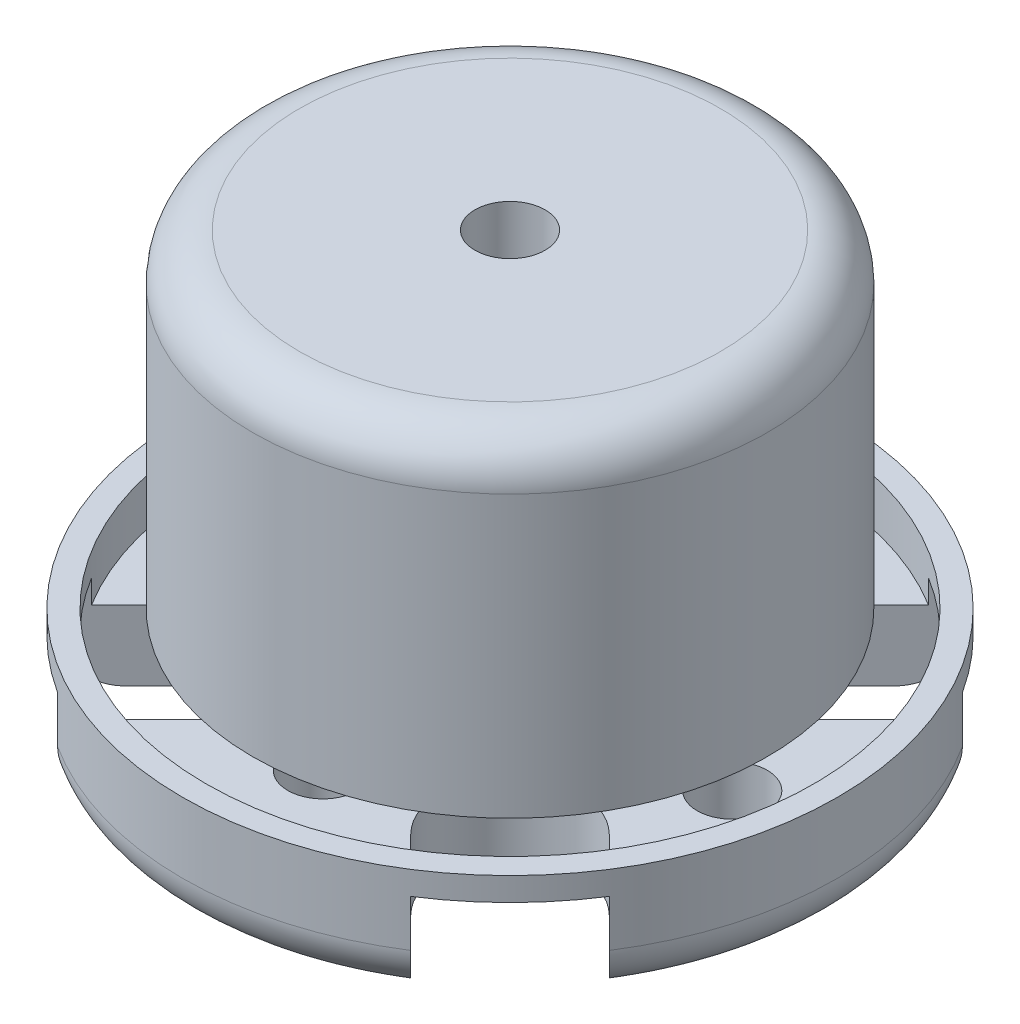
from build123d import *

# Parameters (mm, degrees)
SKETCH_1_R          = 14
SKETCH_1_R_2        = 1.5
EXTRUDE_1_DEPTH     = 5
SKETCH_2_R          = 13
SKETCH_2_R_2        = 4.5
CUT_EXTRUDE_1_DEPTH = 2
SKETCH_3_R          = 1.5
CUT_EXTRUDE_2_DEPTH = 21.420577857
SKETCH_4_R          = 4
CUT_EXTRUDE_3_DEPTH = 3
CUT_EXTRUDE_4_DEPTH = 4
FILLET_1_R          = 2
EXTRUDE_START       = 14
SKETCH_6_R          = 11
SKETCH_6_R_2        = 1.5
EXTRUDE_3_DEPTH     = 14
FILLET_2_R          = 2


with BuildPart() as part:
    # 草图1 → 凸台-拉伸1 (new body)
    with BuildSketch(Plane(origin=(0, 0, 0), x_dir=(1, 0, 0), z_dir=(0, 1, 0))):
        with Locations(Location((0, 0, 0), (0, 0, 270))):
            Circle(SKETCH_1_R)
        with Locations(Location((-9.5, 0, 0), (0, 0, 270))):
            Circle(SKETCH_1_R_2, mode=Mode.SUBTRACT)
        with Locations(Location((9.5, 0, 0), (0, 0, 270))):
            Circle(SKETCH_1_R_2, mode=Mode.SUBTRACT)
        with Locations(Location((0, 8, 0), (0, 0, 270))):
            Circle(SKETCH_1_R_2, mode=Mode.SUBTRACT)
        with Locations(Location((0, -8, 0), (0, 0, 270))):
            Circle(SKETCH_1_R_2, mode=Mode.SUBTRACT)
    extrude(amount=EXTRUDE_1_DEPTH)

    # 草图2 → 切除-拉伸1 (cut)
    with BuildSketch(Plane(origin=(0, 5, 0), x_dir=(1, 0, 0), z_dir=(0, 1, 0))):
        with Locations(Location((0, 0, 0), (0, 0, 270))):
            Circle(SKETCH_2_R)
        with Locations(Location((0, 0, 0), (0, 0, 270))):
            Circle(SKETCH_2_R_2, mode=Mode.SUBTRACT)
    extrude(amount=-CUT_EXTRUDE_1_DEPTH, mode=Mode.SUBTRACT)

    # 草图3 → 切除-拉伸2 (cut, through all)
    with BuildSketch(Plane(origin=(0, 5, 0), x_dir=(1, 0, 0), z_dir=(0, 1, 0))):
        with Locations(Location((0, 0, 0), (0, 0, 270))):
            Circle(SKETCH_3_R)
    extrude(amount=-CUT_EXTRUDE_2_DEPTH, mode=Mode.SUBTRACT)

    # 草图4 → 切除-拉伸3 (cut)
    with BuildSketch(Plane.XZ):
        with Locations(Location((0, 0, 0), (0, 0, 270))):
            Circle(SKETCH_4_R)
    extrude(amount=-CUT_EXTRUDE_3_DEPTH, mode=Mode.SUBTRACT)

    # 草图5 → 切除-拉伸4 (cut)
    with BuildSketch(Plane.XZ):
        with BuildLine():
            Line((8.485281374, 4.242640687), (11.790860146, 7.548219459))
            ThreePointArc((11.790860146, 7.548219459), (9.899494937, 9.899494937), (7.548219459, 11.790860146))
            Line((7.548219459, 11.790860146), (4.242640687, 8.485281374))
            ThreePointArc((4.242640687, 8.485281374), (4.242640687, 4.242640687), (8.485281374, 4.242640687))
        make_face()
        with BuildLine():
            Line((8.485281374, -4.242640687), (11.790860146, -7.548219459))
            ThreePointArc((11.790860146, -7.548219459), (9.899494937, -9.899494937), (7.548219459, -11.790860146))
            Line((7.548219459, -11.790860146), (4.242640687, -8.485281374))
            ThreePointArc((4.242640687, -8.485281374), (4.242640687, -4.242640687), (8.485281374, -4.242640687))
        make_face()
        with BuildLine():
            Line((-4.242640687, -8.485281374), (-7.548219459, -11.790860146))
            ThreePointArc((-7.548219459, -11.790860146), (-9.899494937, -9.899494937), (-11.790860146, -7.548219459))
            Line((-11.790860146, -7.548219459), (-8.485281374, -4.242640687))
            ThreePointArc((-8.485281374, -4.242640687), (-4.242640687, -4.242640687), (-4.242640687, -8.485281374))
        make_face()
        with BuildLine():
            Line((-8.485281374, 4.242640687), (-11.790860146, 7.548219459))
            ThreePointArc((-11.790860146, 7.548219459), (-9.899494937, 9.899494937), (-7.548219459, 11.790860146))
            Line((-7.548219459, 11.790860146), (-4.242640687, 8.485281374))
            ThreePointArc((-4.242640687, 8.485281374), (-4.242640687, 4.242640687), (-8.485281374, 4.242640687))
        make_face()
    extrude(amount=-CUT_EXTRUDE_4_DEPTH, mode=Mode.SUBTRACT)

    # 圆角1
    fillet_1_edges = [part.edges().sort_by_distance(p)[0] for p in [
        (3.932426601, 0, 13.436369339),
        (14, 0, 0),
        (0, 0, -14),
        (-14, 0, 0),
    ]]
    fillet(fillet_1_edges, radius=FILLET_1_R)

    # 草图6 → 凸台-拉伸3 (add)
    with BuildSketch(Plane(origin=(0, 5, 0), x_dir=(1, 0, 0), z_dir=(0, 1, 0)).offset(EXTRUDE_START)):
        with Locations(Location((0, 0, 0), (0, 0, 270))):
            Circle(SKETCH_6_R)
        with Locations(Location((0, 0, 0), (0, 0, 270))):
            Circle(SKETCH_6_R_2, mode=Mode.SUBTRACT)
    extrude(amount=-EXTRUDE_3_DEPTH)

    # 圆角2
    fillet_2_edges = [part.edges().sort_by_distance(p)[0] for p in [
        (0, 19, -11),
    ]]
    fillet(fillet_2_edges, radius=FILLET_2_R)


solid = part.part
